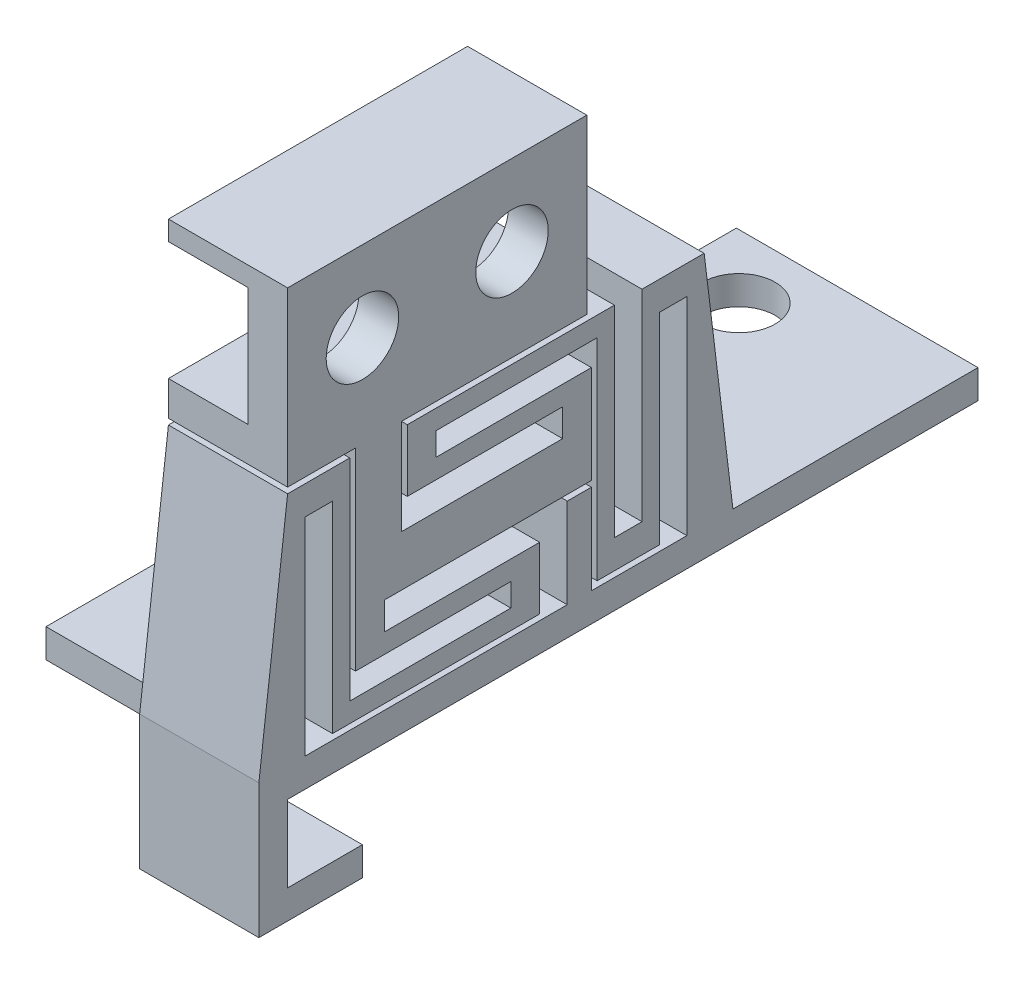
from build123d import *

# Parameters (mm, degrees)
BOSS_EXTRUDE1_DEPTH = 5.18
CUT_EXTRUDE1_REACH  = 33.131
SKETCH2_W           = 3.45
SKETCH2_H           = 5.15
SKETCH3_W           = 10.5
SKETCH3_H           = 30
SKETCH3_R           = 1.575
BOSS_EXTRUDE2_DEPTH = 1.25
CUT_EXTRUDE3_REACH  = 41.726
SKETCH7_R           = 1.575
SKETCH9_W           = 1.05
SKETCH9_H           = 3.9
BOSS_EXTRUDE3_DEPTH = 5.18


with BuildPart() as part:
    # Sketch1 → Boss-Extrude1 (new body)
    with BuildSketch(Plane(origin=(0, 0, 0), x_dir=(0, 0, -1), z_dir=(1, 0, 0))):
        Polygon((0, 0), (13, 0), (13, -7.5), (4.95, -7.5), (4.95, -11.65), (11.95, -11.65), (11.95, -10.45), (5.2, -10.45), (5.2, -7.75), (14.2, -7.75), (14.2, -16.5), (15.4, -16.5), (15.4, -7.75), (18.1, -7.75), (19.35, -18), (19.35, -19.25), (0, -19.25), (0, -22.58), (3.25, -22.58), (3.25, -23.83), (-1.25, -23.83), (-1.25, -18), (0, -7.75), (2.7, -7.75), (2.7, -16.9), (9.7, -16.9), (9.7, -15.9), (2.95, -15.9), (2.95, -7.5), (0, -7.5), align=None)
        Polygon((13.2, -9.6), (13.2, -13.85), (4.2, -13.85), (4.2, -15.05), (10.95, -15.05), (10.95, -17.75), (1.95, -17.75), (1.95, -9), (0.75, -9), (0.75, -18), (17.35, -18), (17.35, -9), (16.15, -9), (16.15, -17.75), (13.45, -17.75), (13.45, -8.6), (6.45, -8.6), (6.45, -9.6), align=None, mode=Mode.SUBTRACT)
    extrude(amount=BOSS_EXTRUDE1_DEPTH)

    # Sketch2 → Cut-Extrude1 (cut, up to next)
    with BuildSketch(Plane.XY, mode=Mode.PRIVATE) as cut_extrude1_sk1:
        with Locations((3.455, -3.425)):
            Rectangle(SKETCH2_W, SKETCH2_H)
    cut_extrude1_tool1 = extrude(cut_extrude1_sk1.sketch, amount=-CUT_EXTRUDE1_REACH, mode=Mode.PRIVATE) & part.part
    add(cut_extrude1_tool1.solids().sort_by_distance((3.455, -3.425, 0))[0], mode=Mode.SUBTRACT)

    # Sketch3 → Boss-Extrude2 (add)
    with BuildSketch(Plane.XZ.offset(19.25)):
        with Locations((5.25, -15)):
            Rectangle(SKETCH3_W, SKETCH3_H)
        with Locations(Location((7.62, -15.23, 0), (0, 0, 270))):
            Circle(SKETCH3_R, mode=Mode.SUBTRACT)
        with Locations(Location((7.62, -27.23, 0), (0, 0, 270))):
            Circle(SKETCH3_R, mode=Mode.SUBTRACT)
    extrude(amount=-BOSS_EXTRUDE2_DEPTH)

    # Sketch7 → Cut-Extrude3 (cut, up to next)
    with BuildSketch(Plane.ZY, mode=Mode.PRIVATE) as cut_extrude3_sk1:
        with Locations((-3.25, -3.5)):
            Circle(SKETCH7_R)
    cut_extrude3_tool1 = extrude(cut_extrude3_sk1.sketch, amount=-CUT_EXTRUDE3_REACH, mode=Mode.PRIVATE) & part.part
    # Sketch7 → Cut-Extrude3 (cut, up to next)
    with BuildSketch(Plane.ZY, mode=Mode.PRIVATE) as cut_extrude3_sk2:
        with Locations((-9.75, -3.5)):
            Circle(SKETCH7_R)
    cut_extrude3_tool2 = extrude(cut_extrude3_sk2.sketch, amount=-CUT_EXTRUDE3_REACH, mode=Mode.PRIVATE) & part.part
    add(cut_extrude3_tool1.solids().sort_by_distance((0, -3.5, -3.25))[0], mode=Mode.SUBTRACT)
    add(cut_extrude3_tool2.solids().sort_by_distance((0, -3.5, -9.75))[0], mode=Mode.SUBTRACT)

    # Sketch9 → Boss-Extrude3 (add)
    with BuildSketch(Plane.ZY):
        with Locations((-12.675, -16.05)):
            Rectangle(SKETCH9_W, SKETCH9_H)
    extrude(amount=-BOSS_EXTRUDE3_DEPTH)


with BuildPart() as body_2:
    # Mirror3: mirrored copy
    add(part.part.mirror(Plane(origin=(0, 0, 0), x_dir=(0, 0, 1), z_dir=(1, 0, 0))))


solid = body_2.part
